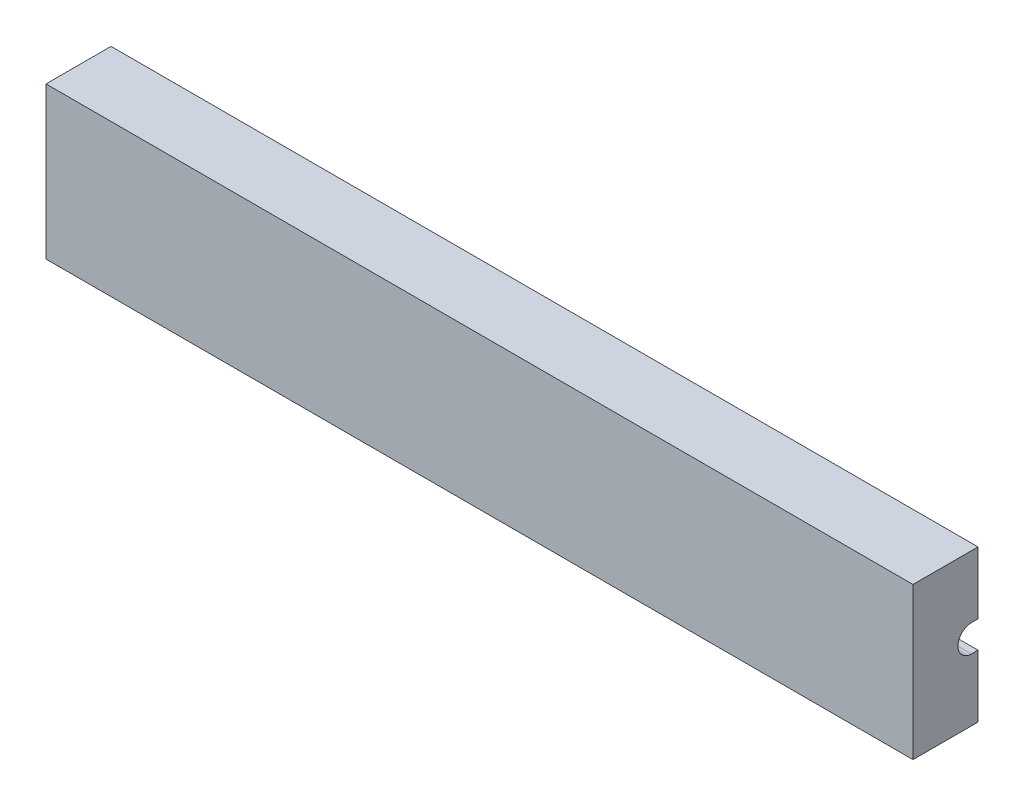
from build123d import *

# Parameters (mm, degrees)
BOSS_EXTRUDE1_DEPTH      = 60
BOSS_EXTRUDE1_DEPTH_BACK = 20


with BuildPart() as part:
    # Sketch1 → Boss-Extrude1 (new, two sides: drawn at the far end of the back side and taken through both)
    with BuildSketch(Plane(origin=(190.645148, 0, 0), x_dir=(0, 0, -1), z_dir=(1, 0, 0)).offset(-BOSS_EXTRUDE1_DEPTH_BACK)):
        with BuildLine():
            Line((-246.970904961, 208.163538159), (-246.970904961, 205.163538159))
            Line((-246.970904961, 205.163538159), (-246.970904961, 197.163538159))
            Line((-246.970904961, 197.163538159), (-246.970904961, 194.163538159))
            Line((-246.970904961, 194.163538159), (-240.970904961, 194.163538159))
            Line((-240.970904961, 194.163538159), (-240.970904961, 197.163538159))
            Line((-240.970904961, 197.163538159), (-240.970904961, 199.913538158))
            Line((-240.970904961, 199.913538158), (-241.570904961, 199.913538158))
            ThreePointArc((-241.570904961, 199.913538158), (-242.820904961, 201.163538162), (-241.570904955, 202.413538158))
            Line((-241.570904955, 202.413538158), (-240.970904961, 202.413538158))
            Line((-240.970904961, 202.413538158), (-240.970904961, 205.163538159))
            Line((-240.970904961, 205.163538159), (-240.970904961, 208.163538159))
            Line((-240.970904961, 208.163538159), (-246.970904961, 208.163538159))
        make_face()
    extrude(amount=BOSS_EXTRUDE1_DEPTH + BOSS_EXTRUDE1_DEPTH_BACK)


solid = part.part
